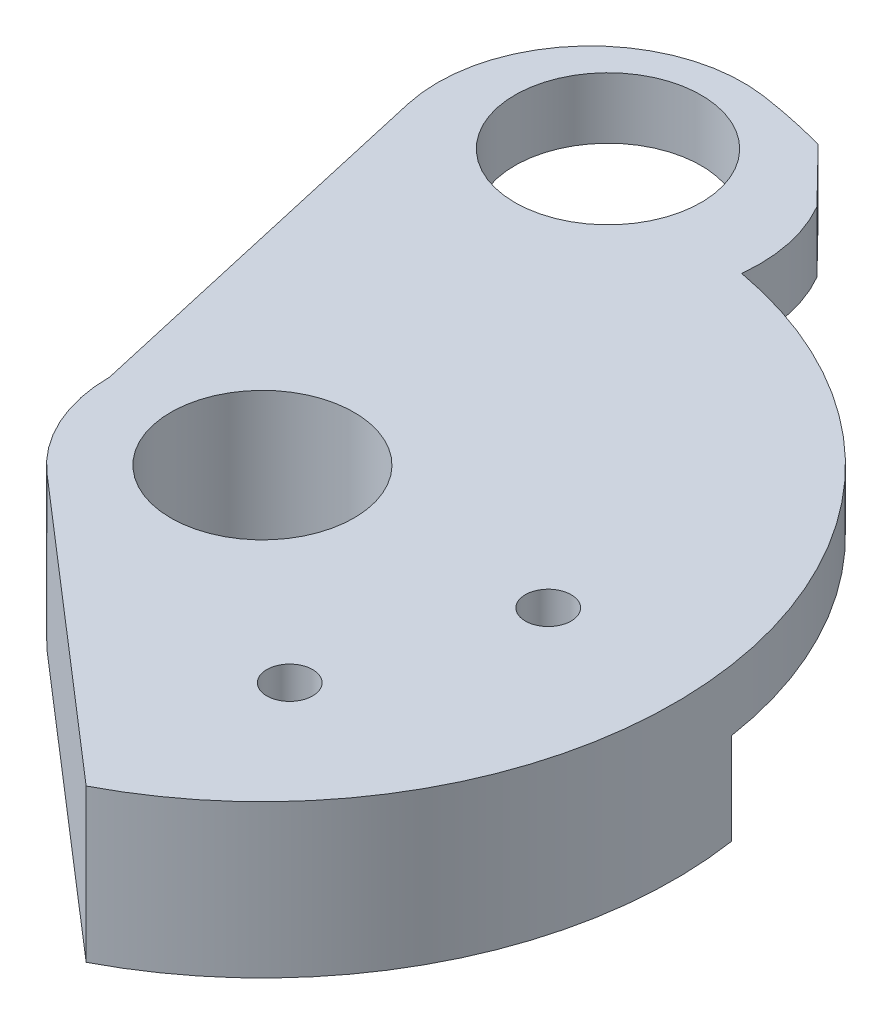
from build123d import *

# Parameters (mm, degrees)
SKETCH_1_R      = 6
SKETCH_1_R_2    = 1.5
EXTRUDE_1_DEPTH = 4
EXTRUDE_START   = -10
SKETCH_2_R      = 6
SKETCH_2_R_2    = 1.5
EXTRUDE_3_DEPTH = 10


with BuildPart() as part:
    # 草图1 → 凸台-拉伸1 (new body)
    # profile 1 of 2: a face of its own
    with BuildSketch(Plane(origin=(0, 0, 0), x_dir=(1, 0, 0), z_dir=(0, 1, 0))):
        with BuildLine():
            ThreePointArc((-11.882996945, 32.788243467), (-20.67500257, 29.68936306), (-23.090953179, 20.685719055))
            Line((-23.090953179, 20.685719055), (-22.448063756, 17.847212503))
            ThreePointArc((-22.448063756, 17.847212503), (-20.341934216, 19.128766183), (-18.127687059, 20.212865348))
            ThreePointArc((-18.127687059, 20.212865348), (-16.454907522, 30.290305128), (-7.901384252, 24.70548431))
            ThreePointArc((-7.901384252, 24.70548431), (-8.01255227, 23.54622097), (-8.342004413, 22.429211075))
            ThreePointArc((-8.342004413, 22.429211075), (-5.436219765, 22.37688115), (-2.552893168, 22.012531633))
            ThreePointArc((-2.552893168, 22.012531633), (-2.714933584, 25.241816969), (-3.873838396, 28.260339871))
            Line((-3.873838396, 28.260339871), (-7.3745684, 31.841047256))
            ThreePointArc((-7.3745684, 31.841047256), (-9.61431765, 32.383495426), (-11.882996945, 32.788243467))
        make_face()
    # profile 2 of 2: a face of its own
    with BuildSketch(Plane(origin=(0, 0, 0), x_dir=(1, 0, 0), z_dir=(0, 1, 0))):
        with BuildLine():
            ThreePointArc((-18.127687059, 20.212865348), (-20.341934216, 19.128766183), (-22.448063756, 17.847212503))
            Line((-22.448063756, 17.847212503), (-17.3745684, -4.553451276))
            ThreePointArc((-17.3745684, -4.553451276), (-16.46911872, -8.71147418), (-13.916737505, -12.116520983))
            Line((-13.916737505, -12.116520983), (5.051344821, -28.524197627))
            ThreePointArc((5.051344821, -28.524197627), (7.070533196, -27.364392508), (8.982279547, -26.034920622))
            ThreePointArc((8.982279547, -26.034920622), (10.160528905, -25.084412347), (11.283653654, -24.069361447))
            ThreePointArc((11.283653654, -24.069361447), (13.156392672, -22.088548581), (14.819857518, -19.928998687))
            ThreePointArc((14.819857518, -19.928998687), (15.646716038, -18.660912524), (16.40120317, -17.348477117))
            ThreePointArc((16.40120317, -17.348477117), (17.570178978, -14.88590395), (18.484890443, -12.318011044))
            ThreePointArc((18.484890443, -12.318011044), (18.879419451, -10.8564761), (19.19141451, -9.375126508))
            ThreePointArc((19.19141451, -9.375126508), (19.516708425, -6.974036065), (19.6254316, -4.553451276))
            ThreePointArc((19.6254316, -4.553451276), (19.623728487, -4.250193605), (19.618619362, -3.946974192))
            ThreePointArc((19.618619362, -3.946974192), (19.542199611, -2.435055692), (19.381162346, -0.929796734))
            ThreePointArc((19.381162346, -0.929796734), (18.879419451, 1.749573548), (18.110066991, 4.364696458))
            ThreePointArc((18.110066991, 4.364696458), (17.570178978, 5.779001398), (16.951872839, 7.160824487))
            ThreePointArc((16.951872839, 7.160824487), (15.646716038, 9.554009971), (14.106900946, 11.80339667))
            ThreePointArc((14.106900946, 11.80339667), (13.156392672, 12.981646029), (12.141341771, 14.104770777))
            ThreePointArc((12.141341771, 14.104770777), (10.160528905, 15.977509795), (8.000979011, 17.640974641))
            ThreePointArc((8.000979011, 17.640974641), (6.732892848, 18.467833161), (5.420457441, 19.222320294))
            ThreePointArc((5.420457441, 19.222320294), (2.957884274, 20.391296102), (0.389991368, 21.306007566))
            ThreePointArc((0.389991368, 21.306007566), (-1.071543576, 21.700536575), (-2.552893168, 22.012531633))
            ThreePointArc((-2.552893168, 22.012531633), (-5.436219765, 22.37688115), (-8.342004413, 22.429211075))
            ThreePointArc((-8.342004413, 22.429211075), (-12.653931695, 18.756167408), (-18.127687059, 20.212865348))
        make_face()
        with Locations(Location((-7.3745684, -4.553451276, 0), (0, 0, 270))):
            Circle(SKETCH_1_R, mode=Mode.SUBTRACT)
        with Locations(Location((5.860803588, -16.002247211, 0), (0, 0, 270))):
            Circle(SKETCH_1_R_2, mode=Mode.SUBTRACT)
        with Locations(Location((10.079774126, -3.290151234, 0), (0, 0, 270))):
            Circle(SKETCH_1_R_2, mode=Mode.SUBTRACT)
    extrude(amount=EXTRUDE_1_DEPTH)

    # 草图2 → 凸台-拉伸3 (add)
    # profile 1 of 2: a face of its own
    with BuildSketch(Plane(origin=(0, 4, 0), x_dir=(1, 0, 0), z_dir=(0, 1, 0)).offset(EXTRUDE_START)):
        with BuildLine():
            ThreePointArc((2.6254316, -4.553451276), (0.461357134, 1.659299405), (-5.094222606, 5.183079064))
            ThreePointArc((-5.094222606, 5.183079064), (-13.587319081, 3.282474258), (-17.3745684, -4.553451276))
            ThreePointArc((-17.3745684, -4.553451276), (-16.46911872, -8.71147418), (-13.916737505, -12.116520983))
            ThreePointArc((-13.916737505, -12.116520983), (-3.216545495, -13.648001596), (2.6254316, -4.553451276))
        make_face()
        with Locations(Location((-7.3745684, -4.553451276, 0), (0, 0, 270))):
            Circle(SKETCH_2_R, mode=Mode.SUBTRACT)
    # profile 2 of 2: a face of its own
    with BuildSketch(Plane(origin=(0, 4, 0), x_dir=(1, 0, 0), z_dir=(0, 1, 0)).offset(EXTRUDE_START)):
        with BuildLine():
            Line((19.324871256, -0.535999093), (-5.094222606, 5.183079064))
            ThreePointArc((-5.094222606, 5.183079064), (0.461357134, 1.659299405), (2.6254316, -4.553451276))
            ThreePointArc((2.6254316, -4.553451276), (-3.216545495, -13.648001596), (-13.916737505, -12.116520983))
            Line((-13.916737505, -12.116520983), (5.051344821, -28.524197627))
            ThreePointArc((5.051344821, -28.524197627), (16.678147117, -16.819945325), (19.324871256, -0.535999093))
        make_face()
        with Locations(Location((5.860803588, -16.002247211, 0), (0, 0, 270))):
            Circle(SKETCH_2_R_2, mode=Mode.SUBTRACT)
        with Locations(Location((10.079774126, -3.290151234, 0), (0, 0, 270))):
            Circle(SKETCH_2_R_2, mode=Mode.SUBTRACT)
    extrude(amount=EXTRUDE_3_DEPTH)


solid = part.part
